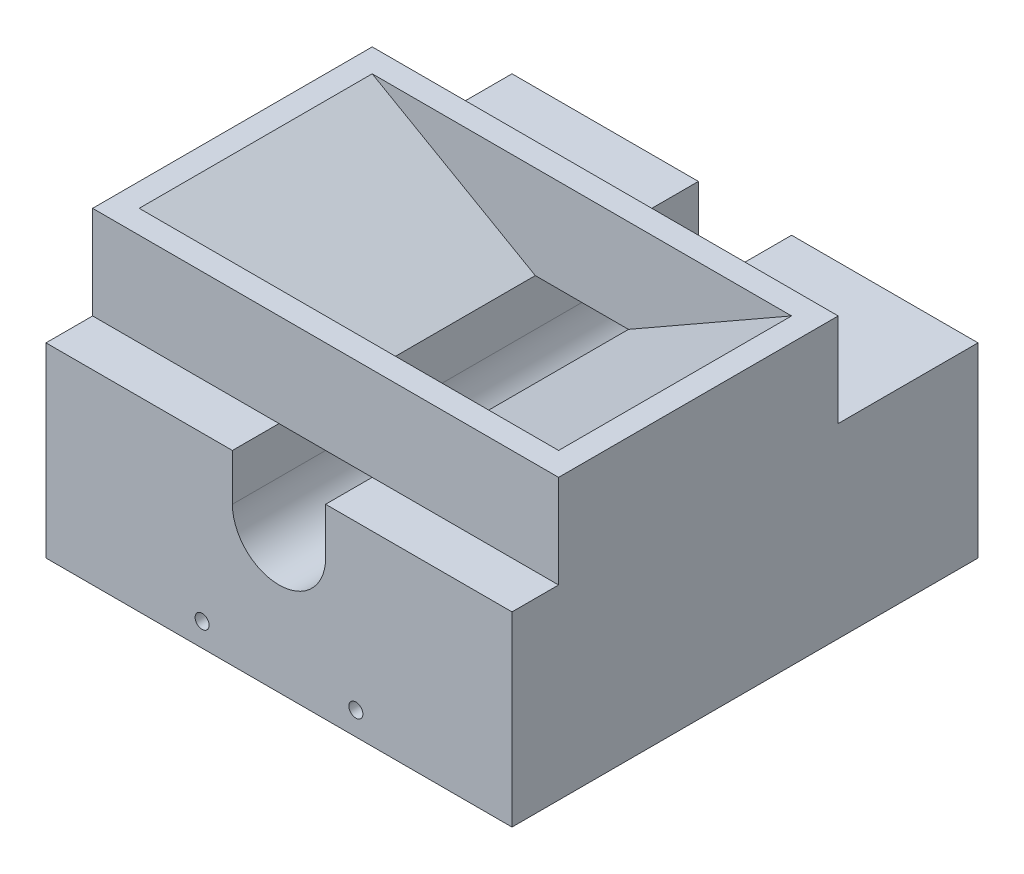
from build123d import *

# Parameters (mm, degrees)
SKETCH4_W           = 100
SKETCH4_H           = 60
BOSS_EXTRUDE2_DEPTH = 100
CUT_EXTRUDE1_DEPTH  = 100
SKETCH7_W           = 30
SKETCH7_H           = 20
CUT_EXTRUDE2_DEPTH  = 100
SKETCH10_W          = 90
SKETCH10_H          = 50
CUT_EXTRUDE6_DEPTH  = 20
BOSS_EXTRUDE3_REACH = 89.321
BOSS_EXTRUDE4_REACH = 89.321
SKETCH13_R          = 1.5
CUT_EXTRUDE7_DEPTH  = 40
SKETCH14_W          = 20
SKETCH14_H          = 40
CUT_EXTRUDE8_DEPTH  = 10
SKETCH15_R          = 1.5
CUT_EXTRUDE9_DEPTH  = 40
SKETCH16_W          = 20
SKETCH16_H          = 40
CUT_EXTRUDE10_DEPTH = 10
SKETCH17_W          = 10
SKETCH17_H          = 20
CUT_EXTRUDE11_DEPTH = 145.568322948


with BuildPart() as part:
    # Sketch4 → Boss-Extrude2 (new body)
    with BuildSketch(Plane.XY):
        Rectangle(SKETCH4_W, SKETCH4_H)
    extrude(amount=BOSS_EXTRUDE2_DEPTH)

    # Sketch6 → Cut-Extrude1 (cut)
    with BuildSketch(Plane.XY.offset(100)):
        with BuildLine():
            Line((-10, 10), (10, 10))
            Line((10, 10), (10, 0))
            ThreePointArc((10, 0), (0, -10), (-10, 0))
            Line((-10, 0), (-10, 10))
        make_face()
    extrude(amount=-CUT_EXTRUDE1_DEPTH, mode=Mode.SUBTRACT)

    # Sketch7 → Cut-Extrude2 (cut)
    with BuildSketch(Plane(origin=(50, 0, 0), x_dir=(0, 0, -1), z_dir=(1, 0, 0))):
        with Locations((-15, 20)):
            Rectangle(SKETCH7_W, SKETCH7_H)
    extrude(amount=-CUT_EXTRUDE2_DEPTH, mode=Mode.SUBTRACT)

    # Sketch10 → Cut-Extrude6 (cut)
    with BuildSketch(Plane(origin=(0, 30, 0), x_dir=(1, 0, 0), z_dir=(0, 1, 0))):
        with Locations((0, -60)):
            Rectangle(SKETCH10_W, SKETCH10_H)
    extrude(amount=-CUT_EXTRUDE6_DEPTH, mode=Mode.SUBTRACT)

    # Sketch11 → Boss-Extrude3 (add, up to next)
    with BuildSketch(Plane.XY.offset(35), mode=Mode.PRIVATE) as boss_extrude3_sk1:
        Polygon((-45, 30), (-45, 10), (-10, 10), align=None)
    boss_extrude3_tool1 = extrude(boss_extrude3_sk1.sketch, amount=BOSS_EXTRUDE3_REACH, mode=Mode.PRIVATE) - part.part
    add(boss_extrude3_tool1.solids().sort_by_distance((-33.333333, 16.666667, 35))[0])

    # Sketch12 → Boss-Extrude4 (add, up to next)
    with BuildSketch(Plane.XY.offset(35), mode=Mode.PRIVATE) as boss_extrude4_sk1:
        Polygon((10, 10), (45, 30), (45, 10), align=None)
    boss_extrude4_tool1 = extrude(boss_extrude4_sk1.sketch, amount=BOSS_EXTRUDE4_REACH, mode=Mode.PRIVATE) - part.part
    add(boss_extrude4_tool1.solids().sort_by_distance((33.333333, 16.666667, 35))[0])

    # Sketch13 → Cut-Extrude7 (cut)
    with BuildSketch(Plane.XY.offset(100)):
        with Locations((-16.5, -25)):
            Circle(SKETCH13_R)
        with Locations((16.5, -25)):
            Circle(SKETCH13_R)
    extrude(amount=-CUT_EXTRUDE7_DEPTH, mode=Mode.SUBTRACT)

    # Sketch14 → Cut-Extrude8 (cut)
    with BuildSketch(Plane.XZ.offset(30)):
        with Locations((-16.5, 75)):
            Rectangle(SKETCH14_W, SKETCH14_H)
        with Locations((16.5, 75)):
            Rectangle(SKETCH14_W, SKETCH14_H)
    extrude(amount=-CUT_EXTRUDE8_DEPTH, mode=Mode.SUBTRACT)

    # Sketch15 → Cut-Extrude9 (cut)
    with BuildSketch(Plane(origin=(0, 0, 0), x_dir=(-1, 0, 0), z_dir=(0, 0, -1))):
        with Locations((-25, -25)):
            Circle(SKETCH15_R)
        with Locations((25, -25)):
            Circle(SKETCH15_R)
    extrude(amount=-CUT_EXTRUDE9_DEPTH, mode=Mode.SUBTRACT)

    # Sketch16 → Cut-Extrude10 (cut)
    with BuildSketch(Plane(origin=(0, -30, 0), x_dir=(-1, 0, 0), z_dir=(0, -1, 0))):
        with Locations((-25, -25)):
            Rectangle(SKETCH16_W, SKETCH16_H)
        with Locations((25, -25)):
            Rectangle(SKETCH16_W, SKETCH16_H)
    extrude(amount=-CUT_EXTRUDE10_DEPTH, mode=Mode.SUBTRACT)

    # Sketch17 → Cut-Extrude11 (cut, through all)
    with BuildSketch(Plane(origin=(50, 0, 0), x_dir=(0, 0, -1), z_dir=(1, 0, 0))):
        with Locations((-95, 20)):
            Rectangle(SKETCH17_W, SKETCH17_H)
    extrude(amount=-CUT_EXTRUDE11_DEPTH, mode=Mode.SUBTRACT)


solid = part.part
